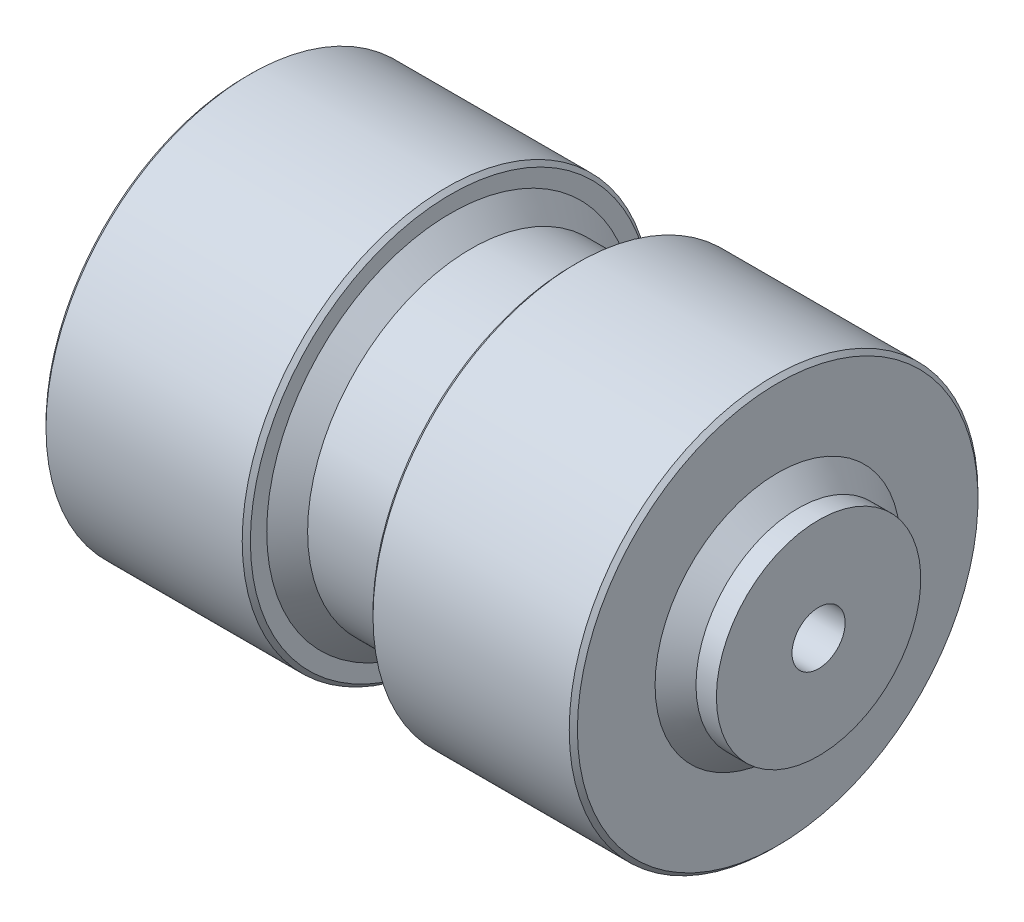
from build123d import *

# Parameters (mm, degrees)
FASE1_SIZE = 0.5
FASE2_SIZE = 0.1


with BuildPart() as part:
    # Skizze1 → Rotation1 (revolve)
    with BuildSketch(Plane.XY, mode=Mode.PRIVATE) as rotation1_sk:
        Polygon((-7.5, 2.5), (-6.5, 2.5), (-6.5, 5), (-1.5, 5), (-1.5, 4), (1.5, 4), (1.5, 5), (6.5, 5), (6.5, 2.5), (7.5, 2.5), (7.5, 0.65), (-7.5, 0.65), align=None)
    revolve(rotation1_sk.sketch.rotate(Axis((-7.5, 0, 0), (1, 0, 0)), 90), axis=Axis((-7.5, 0, 0), (1, 0, 0)))

    # Fase1
    fase1_edges = [part.edges().sort_by_distance(p)[0] for p in [
        (6.5, 0, -2.5),
        (1.5, 0, -4),
        (-1.5, 0, -4),
        (-6.5, 0, -2.5),
    ]]
    chamfer(fase1_edges, length=FASE1_SIZE)

    # Fase2
    fase2_edges = [part.edges().sort_by_distance(p)[0] for p in [
        (6.5, 0, -5),
        (1.5, 0, -5),
        (-1.5, 0, -5),
        (-6.5, 0, -5),
    ]]
    chamfer(fase2_edges, length=FASE2_SIZE)


solid = part.part
